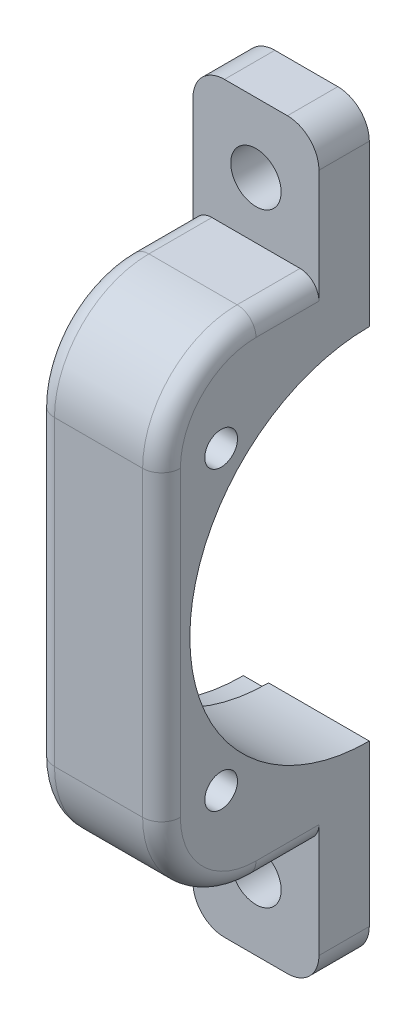
from build123d import *

# Parameters (mm, degrees)
ESQUISSE1_W             = 20
ESQUISSE1_H             = 78
BOSS_EXTRU_1_DEPTH      = 33
ESQUISSE2_W             = 20
ESQUISSE2_H             = 8
BOSS_EXTRU_2_DEPTH      = 20
ESQUISSE3_W             = 20
ESQUISSE3_H             = 8
BOSS_EXTRU_3_DEPTH      = 20
ESQUISSE4_R             = 4
ENL_V_MAT_EXTRU_1_DEPTH = 10
CONG_1_R                = 5
ESQUISSE5_R             = 28.5
ENL_V_MAT_EXTRU_2_DEPTH = 30
ESQUISSE6_R             = 2.6
ENL_V_MAT_EXTRU_3_DEPTH = 20
CONG_4_R                = 15
CONG_5_R                = 3
ESQUISSE7_R             = 29.5
ENL_V_MAT_EXTRU_4_DEPTH = 4


with BuildPart() as part:
    # Esquisse1 → Boss.-Extru.1 (new body)
    with BuildSketch(Plane.XY):
        with Locations((10, 39)):
            Rectangle(ESQUISSE1_W, ESQUISSE1_H)
    extrude(amount=BOSS_EXTRU_1_DEPTH)

    # Esquisse2 → Boss.-Extru.2 (add)
    with BuildSketch(Plane(origin=(0, 78, 0), x_dir=(1, 0, 0), z_dir=(0, 1, 0))):
        with Locations((10, -4)):
            Rectangle(ESQUISSE2_W, ESQUISSE2_H)
    extrude(amount=BOSS_EXTRU_2_DEPTH)

    # Esquisse3 → Boss.-Extru.3 (add)
    with BuildSketch(Plane.XZ):
        with Locations((10, 4)):
            Rectangle(ESQUISSE3_W, ESQUISSE3_H)
    extrude(amount=BOSS_EXTRU_3_DEPTH)

    # Esquisse4 → Enlèv. mat.-Extru.1 (cut)
    with BuildSketch(Plane.XY.offset(8)):
        with Locations((10, 87)):
            Circle(ESQUISSE4_R)
        with Locations(Location((10, -9, 0), (0, 0, 180))):
            Circle(ESQUISSE4_R)
    extrude(amount=-ENL_V_MAT_EXTRU_1_DEPTH, mode=Mode.SUBTRACT)

    # Congé1
    cong_1_edges = [part.edges().sort_by_distance(p)[0] for p in [
        (0, 98, 4),
        (20, 98, 4),
        (0, -20, 4),
        (20, -20, 4),
    ]]
    fillet(cong_1_edges, radius=CONG_1_R)

    # Esquisse5 → Enlèv. mat.-Extru.2 (cut)
    with BuildSketch(Plane(origin=(20, 0, 0), x_dir=(0, 0, -1), z_dir=(1, 0, 0))):
        with Locations((0, 39)):
            Circle(ESQUISSE5_R)
    extrude(amount=-ENL_V_MAT_EXTRU_2_DEPTH, mode=Mode.SUBTRACT)

    # Esquisse6 → Enlèv. mat.-Extru.3 (cut)
    with BuildSketch(Plane(origin=(20, 0, 0), x_dir=(0, 0, -1), z_dir=(1, 0, 0))):
        with Locations((-23.528978144, 15.471021856)):
            Circle(ESQUISSE6_R)
        with Locations((-23.528978144, 62.528978144)):
            Circle(ESQUISSE6_R)
    extrude(amount=-ENL_V_MAT_EXTRU_3_DEPTH, mode=Mode.SUBTRACT)

    # Congé4
    cong_4_edges = [part.edges().sort_by_distance(p)[0] for p in [
        (10, 78, 33),
        (10, 0, 33),
    ]]
    fillet(cong_4_edges, radius=CONG_4_R)

    # Congé5
    cong_5_edges = [part.edges().sort_by_distance(p)[0] for p in [
        (0, 39, 33),
        (20, 39, 33),
        (20, 78, 13),
        (20, 0, 13),
        (20, 73.606601718, 28.606601718),
        (20, 4.393398282, 28.606601718),
        (0, 0, 13),
        (0, 78, 13),
        (0, 73.606601718, 28.606601718),
        (0, 4.393398282, 28.606601718),
    ]]
    fillet(cong_5_edges, radius=CONG_5_R)

    # Esquisse7 → Enlèv. mat.-Extru.4 (cut)
    with BuildSketch(Plane.ZY):
        with Locations((0, 39)):
            Circle(ESQUISSE7_R)
    extrude(amount=-ENL_V_MAT_EXTRU_4_DEPTH, mode=Mode.SUBTRACT)


solid = part.part
